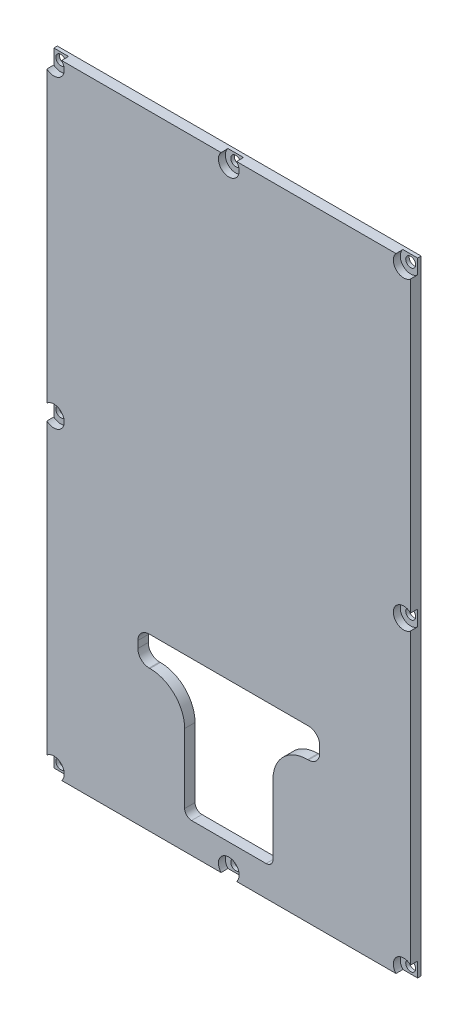
from build123d import *

# Parameters (mm, degrees)
SKETCH_1_W          = 105
SKETCH_1_H          = 180
EXTRUDE_1_DEPTH     = 3
CUT_EXTRUDE_1_DEPTH = 10
SKETCH_3_R          = 3
CUT_EXTRUDE_2_DEPTH = 2
SKETCH_4_R          = 1.425
CUT_EXTRUDE_3_DEPTH = 2


with BuildPart() as part:
    # Эскиз1 → Бобышка-Вытянуть1 (new body)
    with BuildSketch(Plane.XY):
        Rectangle(SKETCH_1_W, SKETCH_1_H)
    extrude(amount=EXTRUDE_1_DEPTH)

    # Эскиз2 → Вырез-Вытянуть1 (cut)
    with BuildSketch(Plane(origin=(0, 0, 0), x_dir=(-1, 0, 0), z_dir=(0, 0, -1))):
        with BuildLine():
            Line((-26.25, -44), (-26.25, -46))
            ThreePointArc((-26.25, -46), (-25.298097039, -48.298097039), (-23, -49.25))
            Line((-23, -49.25), (-22.75, -49.25))
            ThreePointArc((-22.75, -49.25), (-15.678932188, -52.178932188), (-12.75, -59.25))
            Line((-12.75, -59.25), (-12.75, -79.25))
            ThreePointArc((-12.75, -79.25), (-12.164213562, -80.664213562), (-10.75, -81.25))
            Line((-10.75, -81.25), (10.75, -81.25))
            ThreePointArc((10.75, -81.25), (12.164213562, -80.664213562), (12.75, -79.25))
            Line((12.75, -79.25), (12.75, -59.25))
            ThreePointArc((12.75, -59.25), (15.678932188, -52.178932188), (22.75, -49.25))
            Line((22.75, -49.25), (23, -49.25))
            ThreePointArc((23, -49.25), (25.298097039, -48.298097039), (26.25, -46))
            Line((26.25, -46), (26.25, -44))
            ThreePointArc((26.25, -44), (25.298097039, -41.701902961), (23, -40.75))
            Line((23, -40.75), (-23, -40.75))
            ThreePointArc((-23, -40.75), (-25.298097039, -41.701902961), (-26.25, -44))
        make_face()
    extrude(amount=-CUT_EXTRUDE_1_DEPTH, mode=Mode.SUBTRACT)

    # Эскиз3 → Вырез-Вытянуть2 (cut)
    with BuildSketch(Plane.XY.offset(3)):
        with Locations((-50.5, 88)):
            Circle(SKETCH_3_R)
        with Locations((0, 88)):
            Circle(SKETCH_3_R)
        with Locations((50.5, 88)):
            Circle(SKETCH_3_R)
        with Locations((50.5, 0)):
            Circle(SKETCH_3_R)
        with Locations((50.5, -88)):
            Circle(SKETCH_3_R)
        with Locations((0, -88)):
            Circle(SKETCH_3_R)
        with Locations((-50.5, -88)):
            Circle(SKETCH_3_R)
        with Locations((-50.5, 0)):
            Circle(SKETCH_3_R)
    extrude(amount=-CUT_EXTRUDE_2_DEPTH, mode=Mode.SUBTRACT)

    # Эскиз4 → Вырез-Вытянуть3 (cut)
    with BuildSketch(Plane.XY.offset(1)):
        with Locations((-50.5, 88)):
            Circle(SKETCH_4_R)
        with Locations((0, 88)):
            Circle(SKETCH_4_R)
        with Locations((50.5, 88)):
            Circle(SKETCH_4_R)
        with Locations((50.5, 0)):
            Circle(SKETCH_4_R)
        with Locations((50.5, -88)):
            Circle(SKETCH_4_R)
        with Locations((0, -88)):
            Circle(SKETCH_4_R)
        with Locations((-50.5, -88)):
            Circle(SKETCH_4_R)
        with Locations((-50.5, 0)):
            Circle(SKETCH_4_R)
    extrude(amount=-CUT_EXTRUDE_3_DEPTH, mode=Mode.SUBTRACT)


solid = part.part
